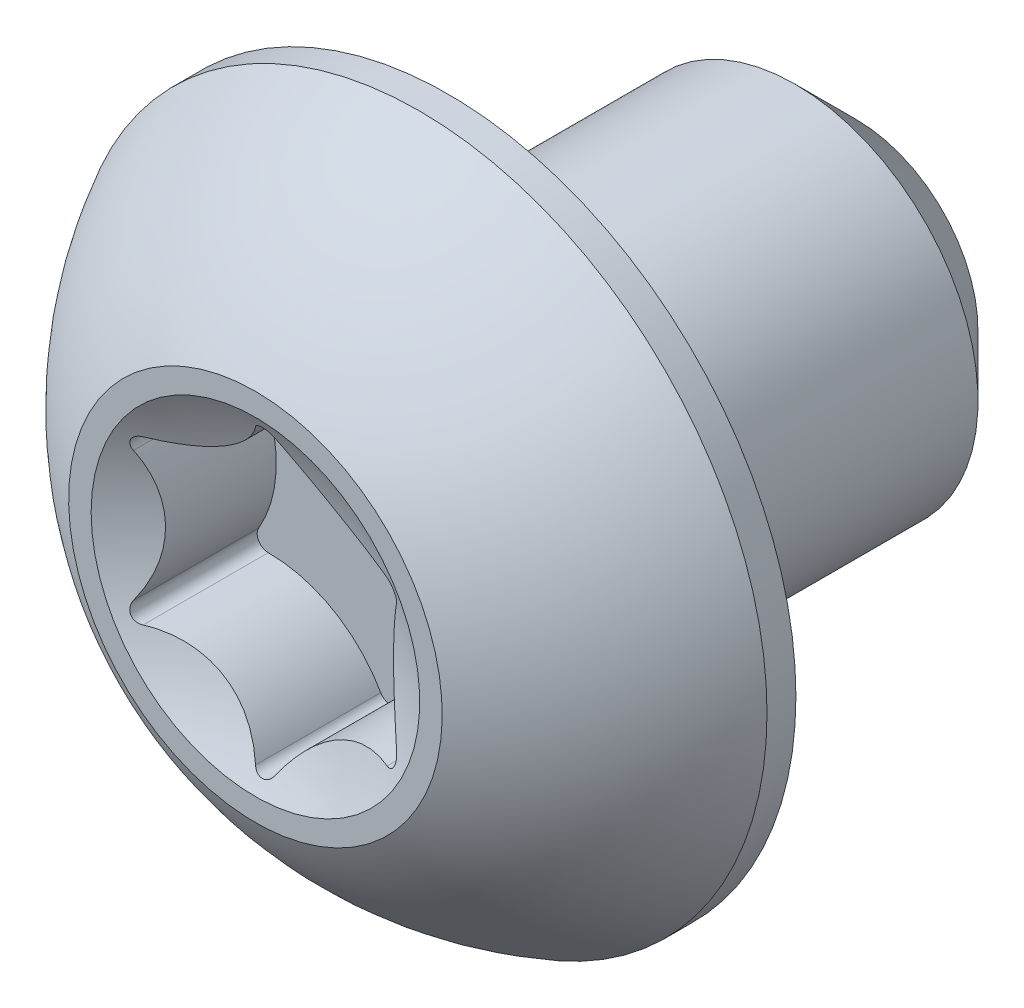
from build123d import *
from build123d.topology import SkipClean

# Parameters (mm, degrees)
CUT_EXTRUDE1_DEPTH       = 1.04902
CIRPATTERN1_COUNT        = 6
CIRPATTERN1_COPY_1_DEPTH = 1.04902
CIRPATTERN1_COPY_2_DEPTH = 1.04902
CIRPATTERN1_COPY_3_DEPTH = 1.04902
CIRPATTERN1_COPY_4_DEPTH = 1.04902
CIRPATTERN1_COPY_5_DEPTH = 1.04902


with BuildPart() as part:
    # Sketch2 → Revolve1 (revolve)
    with BuildSketch(Plane(origin=(0, 0, 0), x_dir=(0, 0, -1), z_dir=(1, 0, 0))):
        Polygon((1.4986, 1.4224), (4.19735, 1.4224), (4.6736, 0.94615), (4.6736, 0), (1.4986, 0), align=None)
    revolve(axis=Axis((0, 0, -4.6736), (0, 0, 1)))


with BuildPart() as body_2:
    # Sketch3 → Revolve2 (revolve)
    with BuildSketch(Plane(origin=(0, 0, 0), x_dir=(0, 0, -1), z_dir=(1, 0, 0))):
        with BuildLine():
            Line((1.4986, 0), (1.4986, 2.7051))
            Line((1.4986, 2.7051), (1.27381, 2.7051))
            ThreePointArc((1.27381, 2.7051), (0.543126817, 2.17424602), (0, 1.4526387))
            Line((0, 1.4526387), (0, 0))
            Line((0, 0), (1.4986, 0))
        make_face()
    revolve(axis=Axis((0, 0, 0), (0, 0, -1)))

    # Combine1: union part
    add(part.part)

    # Sketch4 → Cut-Extrude1 (cut)
    with BuildSketch(Plane.XY):
        with BuildLine():
            Line((-0.886596525, 0), (0, 0))
            Line((0, 0), (-1.023753485, 0.59106435))
            ThreePointArc((-1.023753485, 0.59106435), (-1.035216975, 0.548031955), (-1.023503515, 0.505066928))
            ThreePointArc((-1.023503515, 0.505066928), (-0.921429906, 0.261646769), (-0.886596525, 0))
        make_face()
    cut_extrude1 = extrude(amount=-CUT_EXTRUDE1_DEPTH, mode=Mode.SUBTRACT)

    # Mirror1: Cut-Extrude1 across plane
    add(cut_extrude1.mirror(Plane.ZX), mode=Mode.SUBTRACT)

    # CirPattern1: Cut-Extrude1 ×6 about axis
    cirpattern1_axis = Axis((0, 0, -4.6736), (0, 0, -1))
    for i in range(1, CIRPATTERN1_COUNT):
        add(cut_extrude1.rotate(cirpattern1_axis, i * 360 / CIRPATTERN1_COUNT), mode=Mode.SUBTRACT)

    # CirPattern1 copy 1 sketch → CirPattern1 copy 1 (cut)
    with BuildSketch(Plane(origin=(0, 0, 0), x_dir=(0.5000000000000001, -0.8660254037844386, 0), z_dir=(0, 0, 1))):
        with BuildLine():
            Line((-0.886596525, 0), (0, 0))
            Line((0, 0), (-1.023753485, -0.59106435))
            ThreePointArc((-1.023753485, -0.59106435), (-1.035216975, -0.548031955), (-1.023503515, -0.505066928))
            ThreePointArc((-1.023503515, -0.505066928), (-0.921429906, -0.261646769), (-0.886596525, 0))
        make_face()
    extrude(amount=-CIRPATTERN1_COPY_1_DEPTH, mode=Mode.SUBTRACT)

    # CirPattern1 copy 2 sketch → CirPattern1 copy 2 (cut)
    with BuildSketch(Plane(origin=(0, 0, 0), x_dir=(-0.4999999999999998, -0.8660254037844387, 0), z_dir=(0, 0, 1))):
        with BuildLine():
            Line((-0.886596525, 0), (0, 0))
            Line((0, 0), (-1.023753485, -0.59106435))
            ThreePointArc((-1.023753485, -0.59106435), (-1.035216975, -0.548031955), (-1.023503515, -0.505066928))
            ThreePointArc((-1.023503515, -0.505066928), (-0.921429906, -0.261646769), (-0.886596525, 0))
        make_face()
    extrude(amount=-CIRPATTERN1_COPY_2_DEPTH, mode=Mode.SUBTRACT)

    # CirPattern1 copy 3 sketch → CirPattern1 copy 3 (cut)
    with BuildSketch(Plane(origin=(0, 0, 0), x_dir=(-1, 0, 0), z_dir=(0, 0, 1))):
        with BuildLine():
            Line((-0.886596525, 0), (0, 0))
            Line((0, 0), (-1.023753485, -0.59106435))
            ThreePointArc((-1.023753485, -0.59106435), (-1.035216975, -0.548031955), (-1.023503515, -0.505066928))
            ThreePointArc((-1.023503515, -0.505066928), (-0.921429906, -0.261646769), (-0.886596525, 0))
        make_face()
    extrude(amount=-CIRPATTERN1_COPY_3_DEPTH, mode=Mode.SUBTRACT)

    # CirPattern1 copy 4 sketch → CirPattern1 copy 4 (cut)
    with BuildSketch(Plane(origin=(0, 0, 0), x_dir=(-0.5000000000000004, 0.8660254037844384, 0), z_dir=(0, 0, 1))):
        with BuildLine():
            Line((-0.886596525, 0), (0, 0))
            Line((0, 0), (-1.023753485, -0.59106435))
            ThreePointArc((-1.023753485, -0.59106435), (-1.035216975, -0.548031955), (-1.023503515, -0.505066928))
            ThreePointArc((-1.023503515, -0.505066928), (-0.921429906, -0.261646769), (-0.886596525, 0))
        make_face()
    extrude(amount=-CIRPATTERN1_COPY_4_DEPTH, mode=Mode.SUBTRACT)

    # CirPattern1 copy 5 sketch → CirPattern1 copy 5 (cut)
    with BuildSketch(Plane(origin=(0, 0, 0), x_dir=(0.5000000000000001, 0.8660254037844386, 0), z_dir=(0, 0, 1))):
        with BuildLine():
            Line((-0.886596525, 0), (0, 0))
            Line((0, 0), (-1.023753485, -0.59106435))
            ThreePointArc((-1.023753485, -0.59106435), (-1.035216975, -0.548031955), (-1.023503515, -0.505066928))
            ThreePointArc((-1.023503515, -0.505066928), (-0.921429906, -0.261646769), (-0.886596525, 0))
        make_face()
    extrude(amount=-CIRPATTERN1_COPY_5_DEPTH, mode=Mode.SUBTRACT)

    # Sketch5 → Cut-Revolve1 (revolve, cut)
    with SkipClean():  # the faces are left unmerged after this step: merging them gives an invalid solid
        with BuildSketch(Plane(origin=(0, 0, 0), x_dir=(0, 0, -1), z_dir=(1, 0, 0))):
            with BuildLine():
                Line((-2.159882457, 2.50955579), (-2.159882457, -2.50955579))
                ThreePointArc((-2.159882457, -2.50955579), (0.349673333, 0), (-2.159882457, 2.50955579))
            make_face()
        revolve(axis=Axis((0, 2.50955579, 2.159882457), (0, -1, 0)), mode=Mode.SUBTRACT)


solid = body_2.part
